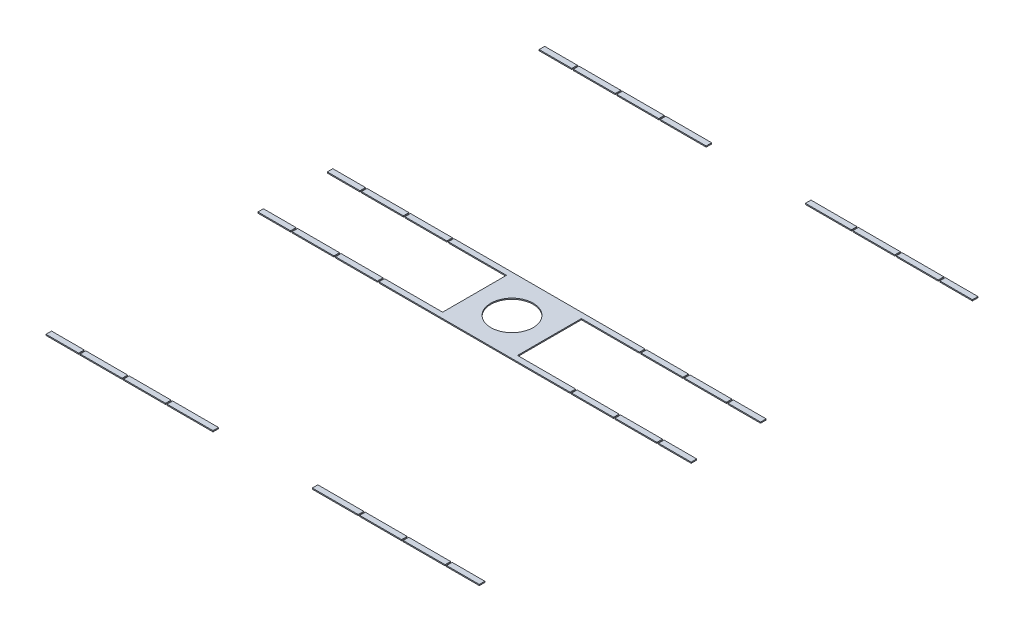
from build123d import *

# Parameters (mm, degrees)
SKETCH1_W           = 22.96
SKETCH1_H           = 22.96
SKETCH1_W_2         = 22.45
SKETCH1_H_2         = 22.45
SKETCH1_W_3         = 9.5
SKETCH1_H_3         = 0.255
SKETCH1_W_4         = 3.45
SKETCH1_H_4         = 3.45
SKETCH1_R           = 0.975
SKETCH1_W_5         = 0.25
SKETCH1_H_5         = 1
BOSS_EXTRUDE5_DEPTH = 0.05
SKETCH2_W           = 0.07
SKETCH2_H           = 0.5
CUT_EXTRUDE1_DEPTH  = 10
SKETCH3_W           = 1.755
SKETCH3_H           = 22.96
SKETCH3_W_2         = 4.572426812
SKETCH3_H_2         = 9.755
CUT_EXTRUDE2_DEPTH  = 10


with BuildPart() as part:
    # Sketch1 → Boss-Extrude5 (new body)
    # profile 1 of 8: a face of its own
    with BuildSketch(Plane(origin=(0, 0, 0), x_dir=(1, 0, 0), z_dir=(0, 1, 0))):
        Rectangle(SKETCH1_W, SKETCH1_H)
        Rectangle(SKETCH1_W_2, SKETCH1_H_2, mode=Mode.SUBTRACT)
    # profile 2 of 8: a face of its own
    with BuildSketch(Plane(origin=(0, 0, 0), x_dir=(1, 0, 0), z_dir=(0, 1, 0))):
        with Locations((-6.475, -1.5975)):
            Rectangle(SKETCH1_W_3, SKETCH1_H_3)
    # profile 3 of 8: a face of its own
    with BuildSketch(Plane(origin=(0, 0, 0), x_dir=(1, 0, 0), z_dir=(0, 1, 0))):
        with Locations((-6.475, 1.5975)):
            Rectangle(SKETCH1_W_3, SKETCH1_H_3)
    # profile 4 of 8: a face of its own
    with BuildSketch(Plane(origin=(0, 0, 0), x_dir=(1, 0, 0), z_dir=(0, 1, 0))):
        Rectangle(SKETCH1_W_4, SKETCH1_H_4)
        with Locations(Location((0, 0, 0), (0, 0, 270))):
            Circle(SKETCH1_R, mode=Mode.SUBTRACT)
    # profile 5 of 8: a face of its own
    with BuildSketch(Plane(origin=(0, 0, 0), x_dir=(1, 0, 0), z_dir=(0, 1, 0))):
        with Locations((6.475, 1.5975)):
            Rectangle(SKETCH1_W_3, SKETCH1_H_3)
    # profile 6 of 8: a face of its own
    with BuildSketch(Plane(origin=(0, 0, 0), x_dir=(1, 0, 0), z_dir=(0, 1, 0))):
        with Locations((6.475, -1.5975)):
            Rectangle(SKETCH1_W_3, SKETCH1_H_3)
    # profile 7 of 8: a face of its own
    with BuildSketch(Plane(origin=(0, 0, 0), x_dir=(1, 0, 0), z_dir=(0, 1, 0))):
        with Locations((-11.605, -1.95)):
            Rectangle(SKETCH1_W_5, SKETCH1_H_5)
    # profile 8 of 8: a face of its own
    with BuildSketch(Plane(origin=(0, 0, 0), x_dir=(1, 0, 0), z_dir=(0, 1, 0))):
        with Locations((-11.605, 1.95)):
            Rectangle(SKETCH1_W_5, SKETCH1_H_5)
    extrude(amount=BOSS_EXTRUDE5_DEPTH)

    # Sketch2 → Cut-Extrude1 (cut)
    with BuildSketch(Plane(origin=(0, 0.05, 0), x_dir=(1, 0, 0), z_dir=(0, 1, 0))):
        with Locations((-6.435, 1.475)):
            Rectangle(SKETCH2_W, SKETCH2_H)
        with Locations((-8.435, 1.475)):
            Rectangle(SKETCH2_W, SKETCH2_H)
        with Locations((-4.435, 1.475)):
            Rectangle(SKETCH2_W, SKETCH2_H)
        with Locations((-4.435, 11.475)):
            Rectangle(SKETCH2_W, SKETCH2_H)
        with Locations((-6.435, 11.475)):
            Rectangle(SKETCH2_W, SKETCH2_H)
        with Locations((-8.435, 11.475)):
            Rectangle(SKETCH2_W, SKETCH2_H)
        with Locations((4.435, 1.475)):
            Rectangle(SKETCH2_W, SKETCH2_H)
        with Locations((6.435, 1.475)):
            Rectangle(SKETCH2_W, SKETCH2_H)
        with Locations((8.435, 1.475)):
            Rectangle(SKETCH2_W, SKETCH2_H)
        with Locations((4.435, 11.475)):
            Rectangle(SKETCH2_W, SKETCH2_H)
        with Locations((6.435, 11.475)):
            Rectangle(SKETCH2_W, SKETCH2_H)
        with Locations((8.435, 11.475)):
            Rectangle(SKETCH2_W, SKETCH2_H)
        with Locations((-8.435, -11.475)):
            Rectangle(SKETCH2_W, SKETCH2_H)
        with Locations((-6.435, -11.475)):
            Rectangle(SKETCH2_W, SKETCH2_H)
        with Locations((-4.435, -11.475)):
            Rectangle(SKETCH2_W, SKETCH2_H)
        with Locations((4.435, -11.475)):
            Rectangle(SKETCH2_W, SKETCH2_H)
        with Locations((6.435, -11.475)):
            Rectangle(SKETCH2_W, SKETCH2_H)
        with Locations((8.435, -11.475)):
            Rectangle(SKETCH2_W, SKETCH2_H)
        with Locations((8.435, -1.475)):
            Rectangle(SKETCH2_W, SKETCH2_H)
        with Locations((6.435, -1.475)):
            Rectangle(SKETCH2_W, SKETCH2_H)
        with Locations((4.435, -1.475)):
            Rectangle(SKETCH2_W, SKETCH2_H)
        with Locations((-4.435, -1.475)):
            Rectangle(SKETCH2_W, SKETCH2_H)
        with Locations((-6.435, -1.475)):
            Rectangle(SKETCH2_W, SKETCH2_H)
        with Locations((-8.435, -1.475)):
            Rectangle(SKETCH2_W, SKETCH2_H)
    extrude(amount=-CUT_EXTRUDE1_DEPTH, mode=Mode.SUBTRACT)

    # Sketch3 → Cut-Extrude2 (cut)
    with BuildSketch(Plane(origin=(0, 0.05, 0), x_dir=(1, 0, 0), z_dir=(0, 1, 0))):
        with Locations((-10.8525, 0)):
            Rectangle(SKETCH3_W, SKETCH3_H)
        with Locations((0, 6.6025)):
            Rectangle(SKETCH3_W_2, SKETCH3_H_2)
        with Locations((0, -6.6025)):
            Rectangle(SKETCH3_W_2, SKETCH3_H_2)
        with Locations((10.8525, 0)):
            Rectangle(SKETCH3_W, SKETCH3_H)
    extrude(amount=-CUT_EXTRUDE2_DEPTH, mode=Mode.SUBTRACT)


solid = part.part
